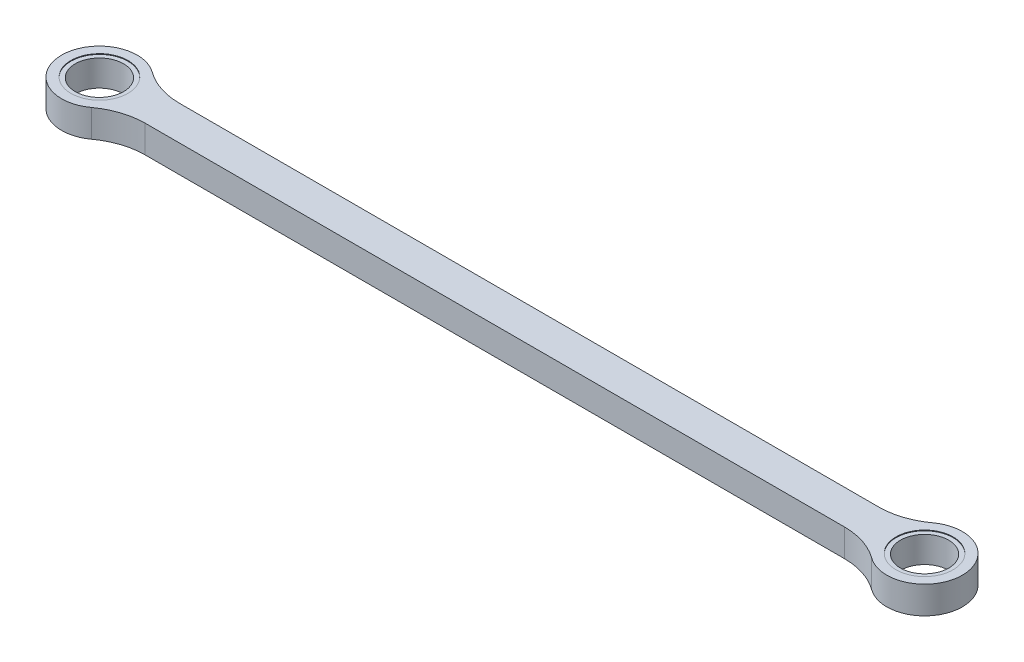
from build123d import *

# Parameters (mm, degrees)
SKETCH_1_R          = 3.515
EXTRUDE_1_DEPTH     = 4
FILLET_1_R          = 10
SKETCH_3_R          = 4.15
CUT_EXTRUDE_2_DEPTH = 0.1
CUT_EXTRUDE_START   = -0.1
SKETCH_4_R          = 4.15
CUT_EXTRUDE_3_DEPTH = 0.1


with BuildPart() as part:
    # 草图1 → 凸台-拉伸1 (new body)
    with BuildSketch(Plane(origin=(0, 0, 0), x_dir=(1, 0, 0), z_dir=(0, 1, 0))):
        with BuildLine():
            Line((4.898979486, 2.5), (115.101020514, 2.5))
            ThreePointArc((115.101020514, 2.5), (125.5, 0), (115.101020514, -2.5))
            Line((115.101020514, -2.5), (4.898979486, -2.5))
            ThreePointArc((4.898979486, -2.5), (-5.5, 0), (4.898979486, 2.5))
        make_face()
        with Locations(Location((0, 0, 0), (0, 0, 270))):
            Circle(SKETCH_1_R, mode=Mode.SUBTRACT)
        with Locations(Location((120, 0, 0), (0, 0, 270))):
            Circle(SKETCH_1_R, mode=Mode.SUBTRACT)
    extrude(amount=EXTRUDE_1_DEPTH)

    # 圆角1
    fillet_1_edges = [part.edges().sort_by_distance(p)[0] for p in [
        (4.898979486, 2, -2.5),
        (115.101020514, 2, -2.5),
        (115.101020514, 2, 2.5),
        (4.898979486, 2, 2.5),
    ]]
    fillet(fillet_1_edges, radius=FILLET_1_R)

    # 草图3 → 切除-拉伸2 (cut)
    with BuildSketch(Plane(origin=(0, 4, 0), x_dir=(1, 0, 0), z_dir=(0, 1, 0))):
        with Locations(Location((0, 0, 0), (0, 0, 270))):
            Circle(SKETCH_3_R)
        with Locations(Location((120, 0, 0), (0, 0, 270))):
            Circle(SKETCH_3_R)
    extrude(amount=-CUT_EXTRUDE_2_DEPTH, mode=Mode.SUBTRACT)

    # 草图4 → 切除-拉伸3 (cut)
    with BuildSketch(Plane.XZ.offset(CUT_EXTRUDE_START)):
        with Locations(Location((0, 0, 0), (0, 0, 90))):
            Circle(SKETCH_4_R)
        with Locations(Location((120, 0, 0), (0, 0, 90))):
            Circle(SKETCH_4_R)
    extrude(amount=CUT_EXTRUDE_3_DEPTH, mode=Mode.SUBTRACT)


solid = part.part
